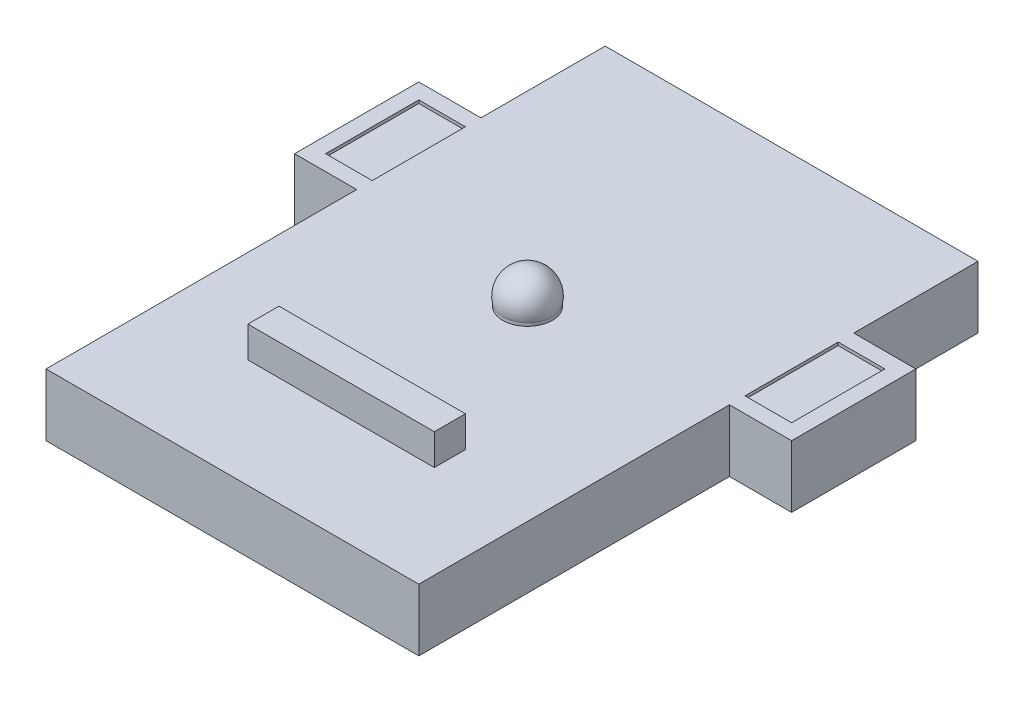
from build123d import *

# Parameters (mm, degrees)
SKETCH1_W           = 152.4
SKETCH1_H           = 228.6
BOSS_EXTRUDE1_DEPTH = 25.4
SKETCH5_W           = 25.4
SKETCH5_H           = 50.8
BOSS_EXTRUDE5_DEPTH = 25.4
SHELL1_T            = -2.54
SKETCH4_W           = 76.2
SKETCH4_H           = 12.7
BOSS_EXTRUDE4_DEPTH = 12.7
SKETCH3_R           = 10.121060994
BOSS_EXTRUDE3_DEPTH = 1.27
DOME1_FACE_RADIUS   = 10.121060994
DOME1_HEIGHT        = 12.7
SKETCH7_W           = 19.05
SKETCH7_H           = 38.1
CUT_EXTRUDE1_DEPTH  = 1.27


with BuildPart() as part:
    # Sketch1 → Boss-Extrude1 (new body)
    with BuildSketch(Plane(origin=(0, 0, 0), x_dir=(1, 0, 0), z_dir=(0, 1, 0))):
        with Locations((76.2, 114.3)):
            Rectangle(SKETCH1_W, SKETCH1_H)
    extrude(amount=BOSS_EXTRUDE1_DEPTH)

    # Sketch5 → Boss-Extrude5 (add)
    with BuildSketch(Plane(origin=(0, 25.4, 0), x_dir=(1, 0, 0), z_dir=(0, 1, 0))):
        with Locations((165.1, 152.4)):
            Rectangle(SKETCH5_W, SKETCH5_H)
        with Locations((-12.7, 152.4)):
            Rectangle(SKETCH5_W, SKETCH5_H)
    extrude(amount=-BOSS_EXTRUDE5_DEPTH)

    # Shell1
    shell1_openings = [part.faces().sort_by_distance(p)[0] for p in [
        (76.2, 0, -116.927586207),
    ]]
    offset(amount=SHELL1_T, openings=shell1_openings, kind=Kind.INTERSECTION)

    # Sketch4 → Boss-Extrude4 (add)
    with BuildSketch(Plane(origin=(0, 25.4, 0), x_dir=(1, 0, 0), z_dir=(0, 1, 0))):
        with Locations((76.2, 50.8)):
            Rectangle(SKETCH4_W, SKETCH4_H)
    extrude(amount=BOSS_EXTRUDE4_DEPTH)

    # Sketch3 → Boss-Extrude3 (add)
    with BuildSketch(Plane(origin=(0, 25.4, 0), x_dir=(1, 0, 0), z_dir=(0, 1, 0))):
        with Locations(Location((76.2, 120.65, 0), (0, 0, 90))):
            Circle(SKETCH3_R)
    extrude(amount=BOSS_EXTRUDE3_DEPTH)

    # Dome1: a dome of height H over a round flat face of radius A is a cap of a sphere of radius (A * A + H * H) / (2 * H)
    dome1_r = (DOME1_FACE_RADIUS * DOME1_FACE_RADIUS + DOME1_HEIGHT * DOME1_HEIGHT) / (2 * DOME1_HEIGHT)
    dome1_base = Plane((76.2, 26.67, -120.65), z_dir=(0, 1, 0))
    with Locations(dome1_base.offset(DOME1_HEIGHT - dome1_r)):
        dome1_ball = Sphere(dome1_r, mode=Mode.PRIVATE)
    add(split(dome1_ball, bisect_by=dome1_base, keep=Keep.TOP, mode=Mode.PRIVATE))

    # Sketch7 → Cut-Extrude1 (cut)
    with BuildSketch(Plane(origin=(0, 25.4, 0), x_dir=(1, 0, 0), z_dir=(0, 1, 0))):
        with Locations((-9.525, 152.4)):
            Rectangle(SKETCH7_W, SKETCH7_H)
        with Locations((161.925, 152.4)):
            Rectangle(SKETCH7_W, SKETCH7_H)
    extrude(amount=-CUT_EXTRUDE1_DEPTH, mode=Mode.SUBTRACT)


solid = part.part
